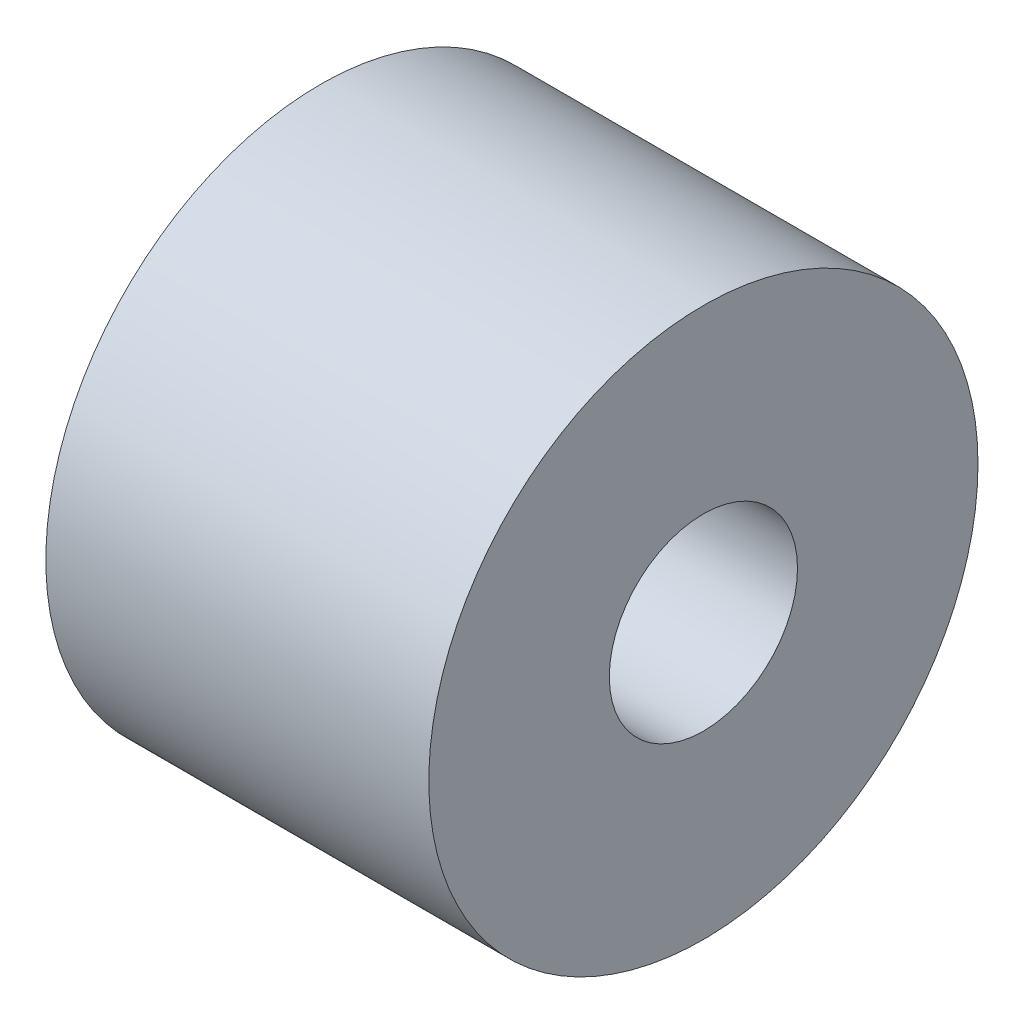
from build123d import *

# Parameters (mm, degrees)
SKETCH1_R      = 9.525
EXTRUDE1_DEPTH = 6.6421
SKETCH2_R      = 3.2639
EXTRUDE2_DEPTH = 19.918805978


with BuildPart() as part:
    # Sketch1 → Extrude1 (new, symmetric)
    with BuildSketch(Plane(origin=(0, 0, 0), x_dir=(0, 0, -1), z_dir=(1, 0, 0))):
        Circle(SKETCH1_R)
    extrude(amount=EXTRUDE1_DEPTH, both=True)

    # Sketch2 → Extrude2 (cut, through all)
    with BuildSketch(Plane(origin=(6.6421, 0, 0), x_dir=(0, 0, -1), z_dir=(1, 0, 0))):
        Circle(SKETCH2_R)
    extrude(amount=-EXTRUDE2_DEPTH, mode=Mode.SUBTRACT)


solid = part.part
